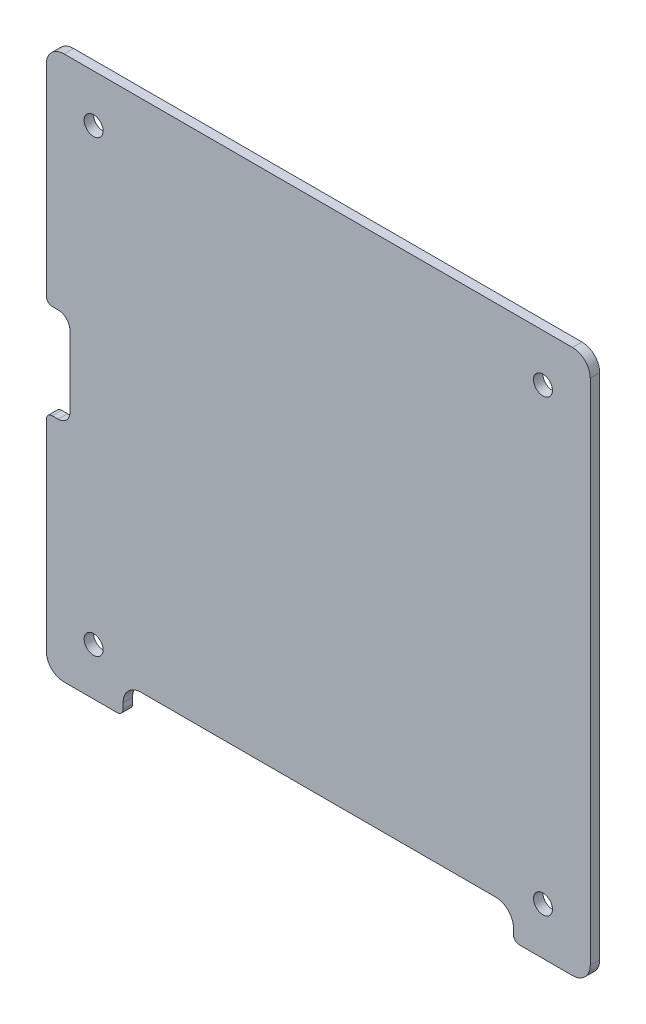
from build123d import *

# Parameters (mm, degrees)
BOSS_EXTRUDE1_DEPTH        = 1.6
F_3_2_3_2_DIAMETER_HOLE1_D = 3.2
FILLET1_R                  = 3
FILLET2_R                  = 1
FILLET3_R                  = 2


with BuildPart() as part:
    # Sketch1 → Boss-Extrude1 (new body)
    with BuildSketch(Plane.XY):
        Polygon((-72.5, 0.75), (-72.5, 5.75), (-6.5, 5.75), (-6.5, 0.75), (6.5, 0.75), (6.5, 92.75), (-85.5, 92.75), (-85.5, 54.75), (-81.5, 54.75), (-81.5, 38.75), (-85.5, 38.75), (-85.5, 0.75), align=None)
    extrude(amount=-BOSS_EXTRUDE1_DEPTH)

    # Ø3.2 (3.2) Diameter Hole1 (through all)
    with Locations(Plane(origin=(0, 0, -1.6), x_dir=(-1, 0, 0), z_dir=(0, 0, -1))):
        with Locations((1.5, 84.75), (1.5, 8.75), (77.5, 8.75), (77.5, 84.75)):
            Hole(F_3_2_3_2_DIAMETER_HOLE1_D / 2)

    # Fillet1
    fillet1_edges = [part.edges().sort_by_distance(p)[0] for p in [
        (6.5, 0.75, -0.8),
        (-6.5, 5.75, -0.8),
        (-72.5, 5.75, -0.8),
        (-85.5, 0.75, -0.8),
        (-85.5, 92.75, -0.8),
        (6.5, 92.75, -0.8),
    ]]
    fillet(fillet1_edges, radius=FILLET1_R)

    # Fillet2
    fillet2_edges = [part.edges().sort_by_distance(p)[0] for p in [
        (-6.5, 0.75, -0.8),
        (-72.5, 0.75, -0.8),
        (-85.5, 38.75, -0.8),
        (-85.5, 54.75, -0.8),
    ]]
    fillet(fillet2_edges, radius=FILLET2_R)

    # Fillet3
    fillet3_edges = [part.edges().sort_by_distance(p)[0] for p in [
        (-81.5, 38.75, -0.8),
        (-81.5, 54.75, -0.8),
    ]]
    fillet(fillet3_edges, radius=FILLET3_R)


solid = part.part
